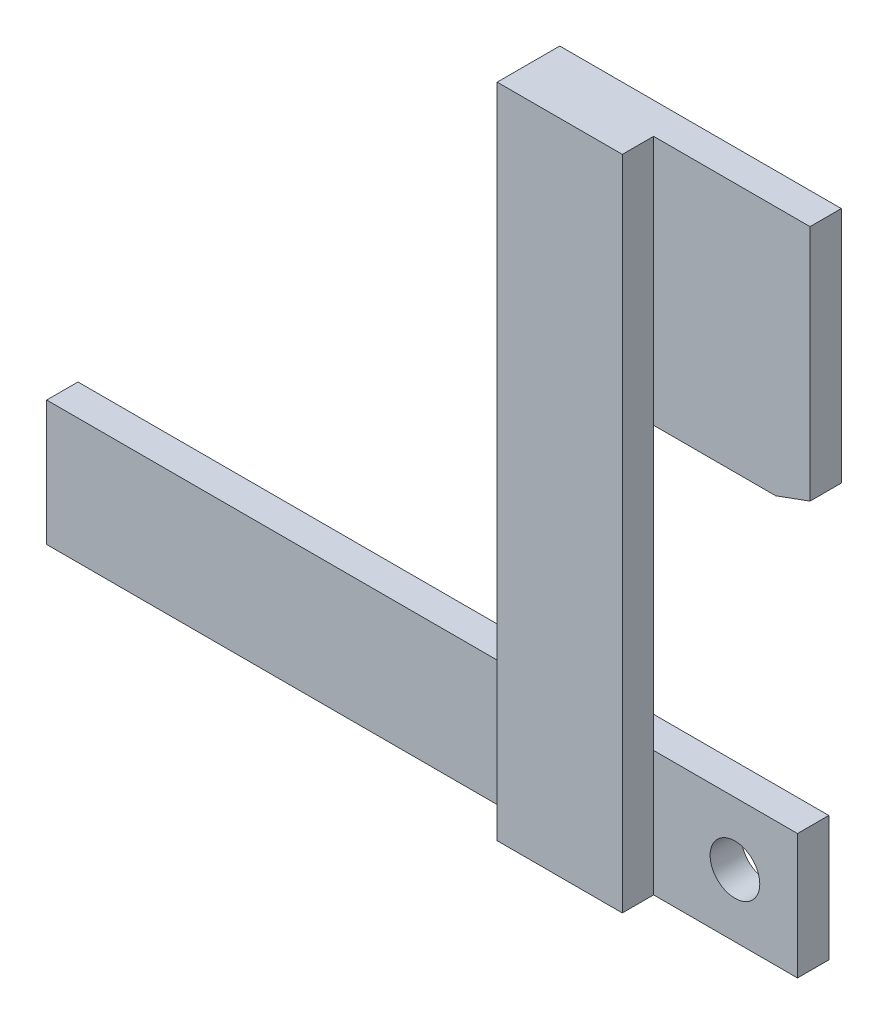
from build123d import *

# Parameters (mm, degrees)
SKETCH1_W                   = 152.4
SKETCH1_H                   = 25.4
EXTRUDE1_DEPTH              = 6.35
SKETCH2_W                   = 25.4
SKETCH2_H                   = 133.35
EXTRUDE2_DEPTH              = 6.35
SKETCH3_W                   = 57.15
SKETCH3_H                   = 50.8
EXTRUDE3_DEPTH              = 6.35
CHAMFER1_SIZE               = 2.54
CHAMFER1_SIZE2              = 6.978592645
F_3_8_CLEARANCE_HOLE1_D     = 10.0838
F_3_8_CLEARANCE_HOLE1_DEPTH = 38.1
F_3_8_CLEARANCE_HOLE1_TIP   = 3.029479155


with BuildPart() as part:
    # Sketch1 → Extrude1 (new body)
    with BuildSketch(Plane.XY):
        Rectangle(SKETCH1_W, SKETCH1_H)
    extrude(amount=EXTRUDE1_DEPTH)

    # Sketch2 → Extrude2 (add)
    with BuildSketch(Plane.XY.offset(6.35)):
        with Locations((34.29, 53.975)):
            Rectangle(SKETCH2_W, SKETCH2_H)
    extrude(amount=EXTRUDE2_DEPTH)

    # Sketch3 → Extrude3 (add)
    with BuildSketch(Plane(origin=(0, 0, 6.35), x_dir=(-1, 0, 0), z_dir=(0, 0, -1))):
        with Locations((-50.165, 95.25)):
            Rectangle(SKETCH3_W, SKETCH3_H)
    extrude(amount=EXTRUDE3_DEPTH)

    # Chamfer1
    chamfer1_edges = [part.edges().sort_by_distance(p)[0] for p in [
        (78.74, 69.85, 3.175),
    ]]
    chamfer1_side = [part.faces().sort_by_distance(p)[0] for p in [
        (78.74, 95.25, 3.175),
    ]]
    chamfer(chamfer1_edges, length=CHAMFER1_SIZE, length2=CHAMFER1_SIZE2, reference=chamfer1_side[0])

    # 3/8 Clearance Hole1
    with Locations(Plane(origin=(63.5, 0, 6.35), x_dir=(1, 0, 0), z_dir=(0, 0, 1))):
        with Locations((0, 0)):
            Hole(F_3_8_CLEARANCE_HOLE1_D / 2, depth=F_3_8_CLEARANCE_HOLE1_DEPTH)
            with Locations((0, 0, -(F_3_8_CLEARANCE_HOLE1_DEPTH + F_3_8_CLEARANCE_HOLE1_TIP / 2))):  # 118° drill point
                Cone(0, F_3_8_CLEARANCE_HOLE1_D / 2, F_3_8_CLEARANCE_HOLE1_TIP, mode=Mode.SUBTRACT)


solid = part.part
